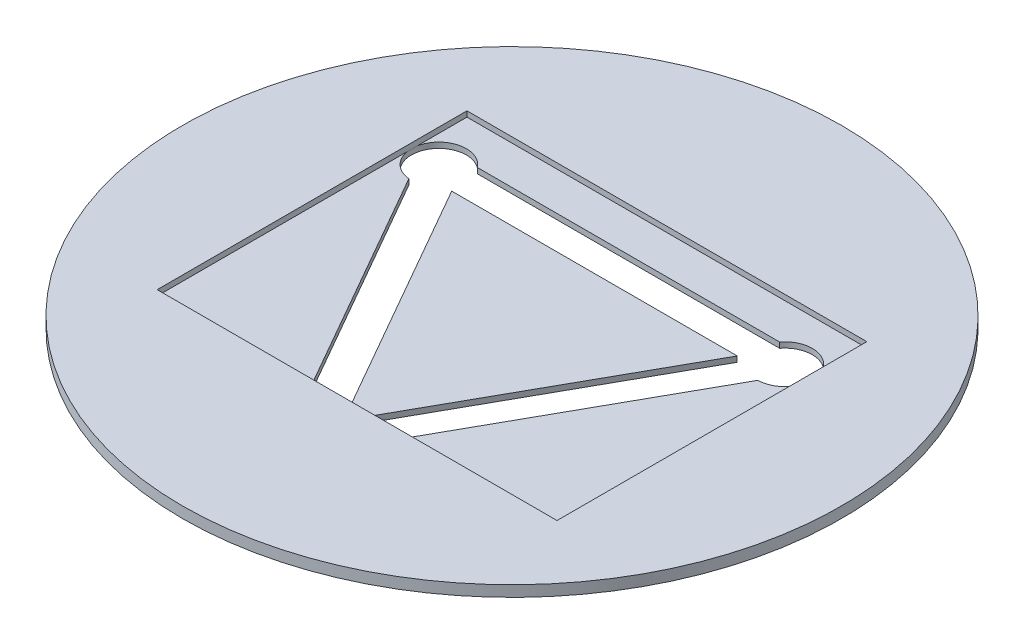
from build123d import *

# Parameters (mm, degrees)
SKETCH1_R           = 150
BOSS_EXTRUDE1_DEPTH = 5
SKETCH2_R           = 12.5
CUT_EXTRUDE1_DEPTH  = 2.5
SKETCH4_W           = 182
SKETCH4_H           = 141
CUT_EXTRUDE2_DEPTH  = 2.5
CUT_EXTRUDE3_DEPTH  = 2.5


with BuildPart() as part:
    # Sketch1 → Boss-Extrude1 (new body)
    with BuildSketch(Plane(origin=(0, 0, 0), x_dir=(1, 0, 0), z_dir=(0, 1, 0))):
        with Locations(Location((0, 0, 0), (0, 0, 270))):
            Circle(SKETCH1_R)
    extrude(amount=BOSS_EXTRUDE1_DEPTH)

    # Sketch2 → Cut-Extrude1 (cut)
    with BuildSketch(Plane.XZ):
        with Locations(Location((0, 90.907224223, 0), (0, 0, 270))):
            Circle(SKETCH2_R)
        with Locations(Location((78.727965565, -45.453612112, 0), (0, 0, 270))):
            Circle(SKETCH2_R)
        with Locations(Location((-78.727965565, -45.453612112, 0), (0, 0, 270))):
            Circle(SKETCH2_R)
    extrude(amount=-CUT_EXTRUDE1_DEPTH, mode=Mode.SUBTRACT)

    # Sketch4 → Cut-Extrude2 (cut)
    with BuildSketch(Plane(origin=(0, 5, 0), x_dir=(1, 0, 0), z_dir=(0, 1, 0))):
        Rectangle(SKETCH4_W, SKETCH4_H)
    extrude(amount=-CUT_EXTRUDE2_DEPTH, mode=Mode.SUBTRACT)

    # Sketch5 → Cut-Extrude3 (cut)
    with BuildSketch(Plane.XZ):
        with BuildLine():
            Line((-11.659324393, 86.400545325), (-79.955582896, -33.014039945))
            ThreePointArc((-79.955582896, -33.014039945), (-67.813794545, -39.360101552), (-68.782668785, -53.0260009))
            Line((-68.782668785, -53.0260009), (68.782668785, -53.0260009))
            ThreePointArc((68.782668785, -53.0260009), (67.573694856, -39.811604938), (78.934736548, -32.955322398))
            Line((78.934736548, -32.955322398), (11.934955449, 87.191468792))
            ThreePointArc((11.934955449, 87.191468792), (0.418787658, 78.414241517), (-11.659324393, 86.400545325))
        make_face()
        Polygon((0.484780027, 77.168816505), (-65.315283199, -37.881223324), (64.642360996, -37.881223324), align=None, mode=Mode.SUBTRACT)
    extrude(amount=-CUT_EXTRUDE3_DEPTH, mode=Mode.SUBTRACT)


solid = part.part
